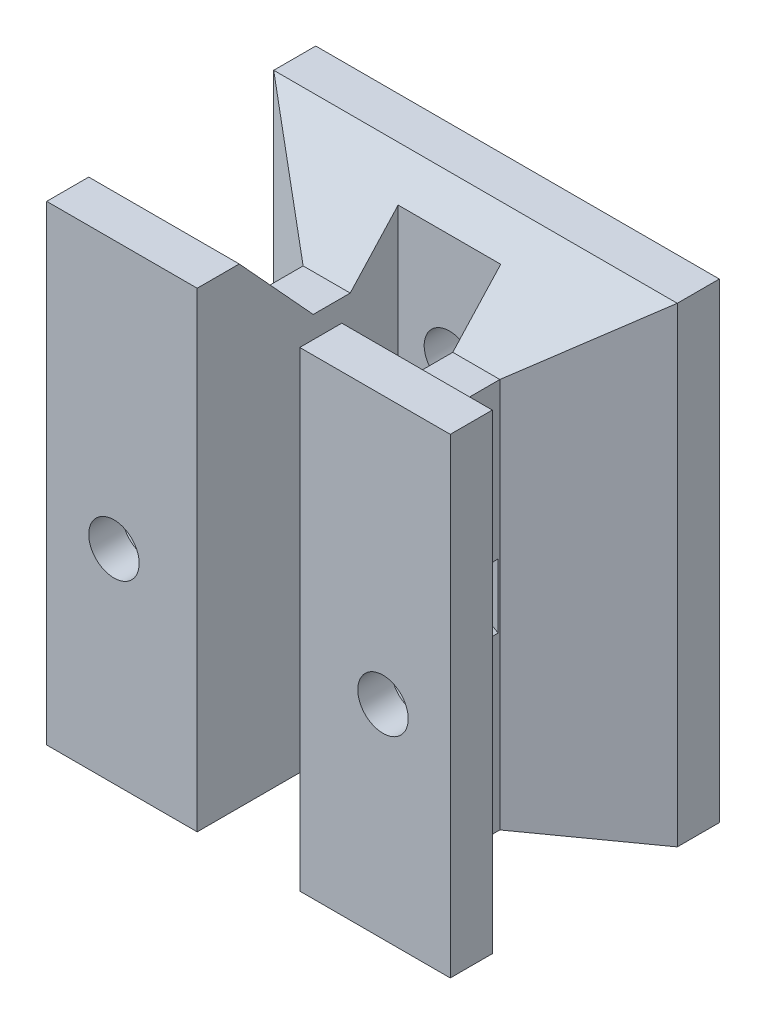
from build123d import *

# Parameters (mm, degrees)
ESBO_O1_W                = 24
ESBO_O1_H                = 28
ESBO_O1_R                = 1.5
RESSALTO_EXTRUS_O1_DEPTH = 16
ESBO_O2_W                = 6.1
ESBO_O2_H                = 11.95
CORTE_EXTRUS_O1_DEPTH    = 41.199502484
CORTE_EXTRUS_O3_DEPTH    = 41.199502484
ESBO_O4_R                = 1.5
CORTE_EXTRUS_O4_DEPTH    = 7
CORTE_EXTRUS_O5_DEPTH    = 9
ESBO_O6_R                = 1.5
RESSALTO_EXTRUS_O2_DEPTH = 2


with BuildPart() as part:
    # Esboço1 → Ressalto-extrusão1 (new body)
    with BuildSketch(Plane.XY):
        with Locations((12, 14)):
            Rectangle(ESBO_O1_W, ESBO_O1_H)
        with Locations((12, 19.85)):
            Circle(ESBO_O1_R, mode=Mode.SUBTRACT)
        with Locations((12, 8.15)):
            Circle(ESBO_O1_R, mode=Mode.SUBTRACT)
    extrude(amount=RESSALTO_EXTRUS_O1_DEPTH)

    # Esboço2 → Corte-extrusão1 (cut, through all)
    with BuildSketch(Plane(origin=(0, 0, 0), x_dir=(1, 0, 0), z_dir=(0, 1, 0))):
        with Locations((12, -10.025)):
            Rectangle(ESBO_O2_W, ESBO_O2_H)
        Polygon((0, -13.5), (6.15, -9.1), (6.15, -6.9), (0, -2.5), align=None)
        Polygon((17.85, -6.9), (24, -2.5), (24, -13.5), (17.85, -9.1), align=None)
    extrude(amount=CORTE_EXTRUS_O1_DEPTH, mode=Mode.SUBTRACT)

    # Esboço3 → Corte-extrusão3 (cut, through all)
    with BuildSketch(Plane(origin=(0, 0, 0), x_dir=(0, 0, -1), z_dir=(1, 0, 0))):
        Polygon((-13.5, 28), (-9.1, 23.2), (-6.9, 23.2), (-2.5, 28), align=None)
    extrude(amount=CORTE_EXTRUS_O3_DEPTH, mode=Mode.SUBTRACT)

    # Esboço4 → Corte-extrusão4 (cut)
    with BuildSketch(Plane.XY.offset(16)):
        with Locations((4, 12.1)):
            Circle(ESBO_O4_R)
        with Locations((20, 12.1)):
            Circle(ESBO_O4_R)
    extrude(amount=-CORTE_EXTRUS_O4_DEPTH, mode=Mode.SUBTRACT)

    # Esboço5 → Corte-extrusão5 (cut)
    with BuildSketch(Plane.XY.offset(16)):
        Polygon((4, 8.95), (6.727980022, 10.525), (6.727980022, 13.675), (4, 15.25), (1.272019978, 13.675), (1.272019978, 10.525), align=None)
        Polygon((20, 8.95), (22.727980022, 10.525), (22.727980022, 13.675), (20, 15.25), (17.272019978, 13.675), (17.272019978, 10.525), align=None)
    extrude(amount=-CORTE_EXTRUS_O5_DEPTH, mode=Mode.SUBTRACT)

    # Esboço6 → Ressalto-extrusão2 (add)
    # profile 1 of 2: a face of its own
    with BuildSketch(Plane.XY.offset(16)):
        Polygon((6.727980022, 10.525), (4, 8.95), (1.272019978, 10.525), (1.272019978, 13.675), (4, 15.25), (6.727980022, 13.675), align=None)
        with Locations((4, 12.1)):
            Circle(ESBO_O6_R, mode=Mode.SUBTRACT)
    # profile 2 of 2: a face of its own
    with BuildSketch(Plane.XY.offset(16)):
        Polygon((17.272019978, 13.675), (17.272019978, 10.525), (20, 8.95), (22.727980022, 10.525), (22.727980022, 13.675), (20, 15.25), align=None)
        with Locations((20, 12.1)):
            Circle(ESBO_O6_R, mode=Mode.SUBTRACT)
    extrude(amount=-RESSALTO_EXTRUS_O2_DEPTH)


solid = part.part
